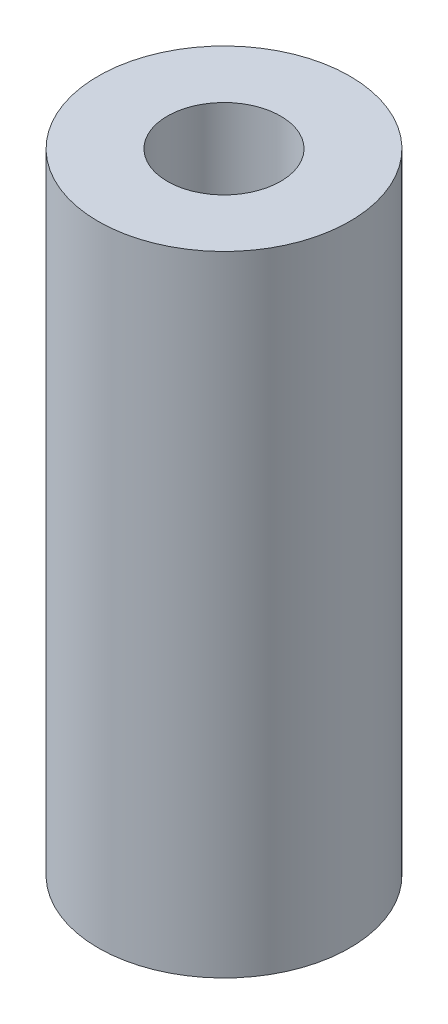
from build123d import *

# Parameters (mm, degrees)
SKETCH1_R           = 4
SKETCH1_R_2         = 1.8
BOSS_EXTRUDE1_DEPTH = 20


with BuildPart() as part:
    # Sketch1 → Boss-Extrude1 (new body)
    with BuildSketch(Plane(origin=(0, 0, 0), x_dir=(1, 0, 0), z_dir=(0, 1, 0))):
        with Locations(Location((0, 0, 0), (0, 0, 270))):
            Circle(SKETCH1_R)
        with Locations(Location((0, 0, 0), (0, 0, 270))):
            Circle(SKETCH1_R_2, mode=Mode.SUBTRACT)
    extrude(amount=BOSS_EXTRUDE1_DEPTH)


solid = part.part
